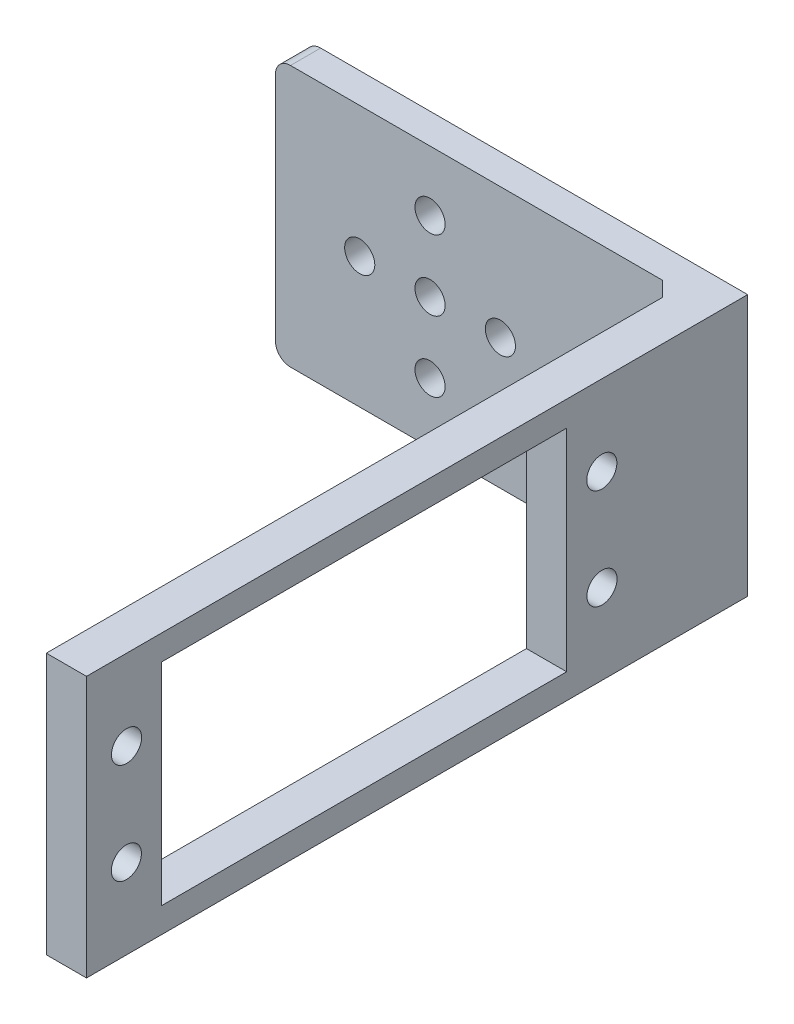
from build123d import *

# Parameters (mm, degrees)
CROQUIS1_R              = 1.5
SALIENTE_EXTRUIR1_DEPTH = 3
CROQUIS2_W              = 4
CROQUIS2_H              = 26
SALIENTE_EXTRUIR2_DEPTH = 62.8
SALIENTE_EXTRUIR3_DEPTH = 26
CROQUIS5_W              = 40.3
CROQUIS5_H              = 21
CROQUIS5_R              = 1.5
CORTAR_EXTRUIR1_DEPTH   = 26


with BuildPart() as part:
    # Croquis1 → Saliente-Extruir1 (new body)
    with BuildSketch(Plane.XY):
        with BuildLine():
            Line((-20.5, -13), (22, -13))
            Line((22, -13), (22, 13))
            Line((22, 13), (-20.5, 13))
            ThreePointArc((-20.5, 13), (-21.560660172, 12.560660172), (-22, 11.5))
            Line((-22, 11.5), (-22, -11.5))
            ThreePointArc((-22, -11.5), (-21.560660172, -12.560660172), (-20.5, -13))
        make_face()
        with Locations((-6.61, 0)):
            Circle(CROQUIS1_R, mode=Mode.SUBTRACT)
        with Locations((-13.61, 0)):
            Circle(CROQUIS1_R, mode=Mode.SUBTRACT)
        with Locations((-6.61, 7)):
            Circle(CROQUIS1_R, mode=Mode.SUBTRACT)
        with Locations((0.39, 0)):
            Circle(CROQUIS1_R, mode=Mode.SUBTRACT)
        with Locations((-6.61, -7)):
            Circle(CROQUIS1_R, mode=Mode.SUBTRACT)
    extrude(amount=SALIENTE_EXTRUIR1_DEPTH)

    # Croquis2 → Saliente-Extruir2 (add)
    with BuildSketch(Plane.XY.offset(3)):
        with Locations((20, 0)):
            Rectangle(CROQUIS2_W, CROQUIS2_H)
    extrude(amount=SALIENTE_EXTRUIR2_DEPTH)

    # Croquis3 → Saliente-Extruir3 (add)
    with BuildSketch(Plane.XZ.offset(13)):
        Polygon((18, 3), (18, 4.5), (16.5, 3), align=None)
    extrude(amount=-SALIENTE_EXTRUIR3_DEPTH)

    # Croquis5 → Cortar-Extruir1 (cut)
    with BuildSketch(Plane.ZY.offset(-18)):
        with Locations((38.1664, 0)):
            Rectangle(CROQUIS5_W, CROQUIS5_H)
        with Locations(Location((14.5, -5, 0), (0, 0, 270))):
            Circle(CROQUIS5_R)
        with Locations(Location((14.5164, 5, 0), (0, 0, 270))):
            Circle(CROQUIS5_R)
        with Locations(Location((61.8164, 5, 0), (0, 0, 270))):
            Circle(CROQUIS5_R)
        with Locations(Location((61.8328, -5, 0), (0, 0, 270))):
            Circle(CROQUIS5_R)
    extrude(amount=-CORTAR_EXTRUIR1_DEPTH, mode=Mode.SUBTRACT)


solid = part.part
